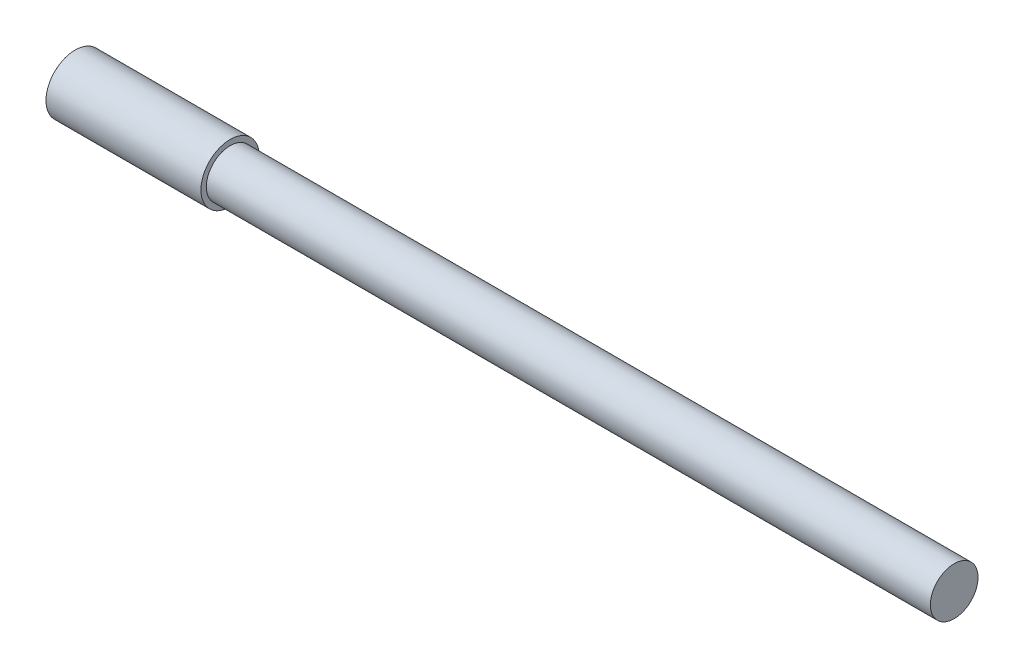
from build123d import *


with BuildPart() as part:
    # Sketch1 → Revolve1 (revolve)
    with BuildSketch(Plane(origin=(0, 0, 0), x_dir=(1, 0, 0), z_dir=(0, 1, 0))):
        Polygon((0, 0), (26, 0), (26, 0.9), (147.5, 0.9), (147.5, 4.9), (0, 4.9), align=None)
    revolve(axis=Axis((0, 0, -4.9), (1, 0, 0)))


solid = part.part
